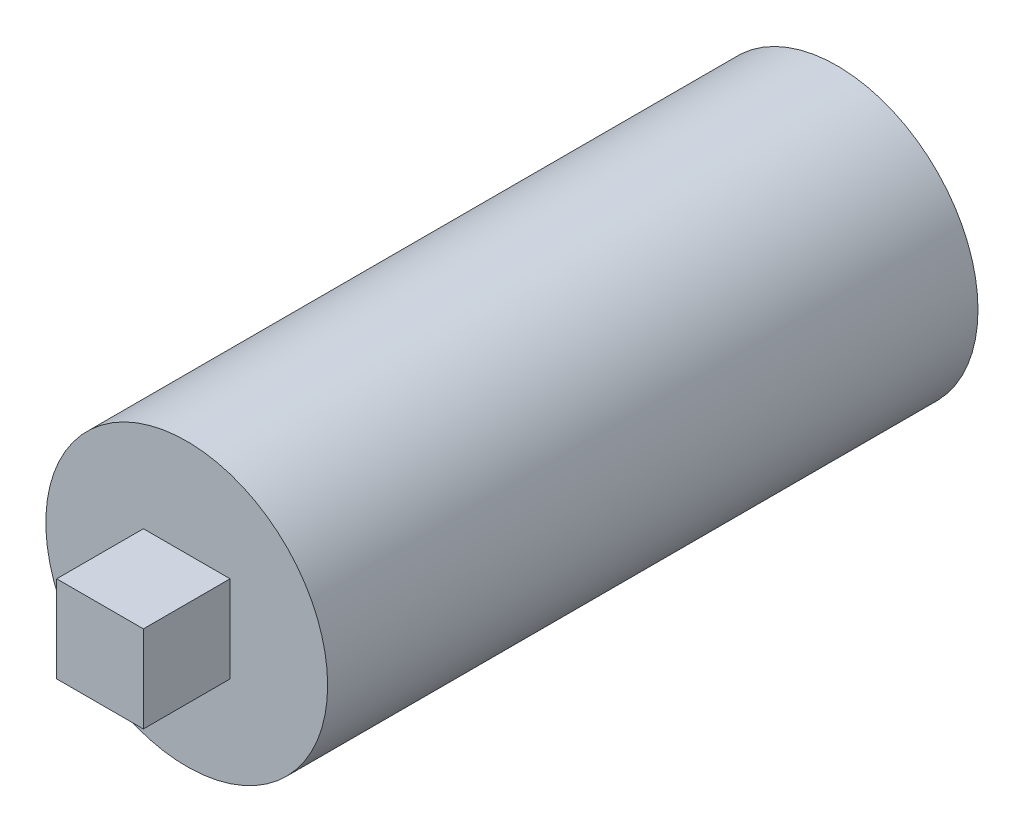
from build123d import *

# Parameters (mm, degrees)
IZIM2_R                     = 32.5
Y_KSEKLIK_EKSTR_ZYON1_DEPTH = 150
IZIM3_W                     = 20
IZIM3_H                     = 20
Y_KSEKLIK_EKSTR_ZYON2_DEPTH = 20
IZIM5_W                     = 20
IZIM5_H                     = 20
KES_EKSTR_ZYON2_DEPTH       = 20
IZIM6_W                     = 20.1
IZIM6_H                     = 20.1
KES_EKSTR_ZYON3_DEPTH       = 20


with BuildPart() as part:
    # Çizim2 → Yükseklik-Ekstrüzyon1 (new body)
    with BuildSketch(Plane.XY):
        Circle(IZIM2_R)
    extrude(amount=Y_KSEKLIK_EKSTR_ZYON1_DEPTH)

    # Çizim3 → Yükseklik-Ekstrüzyon2 (add)
    with BuildSketch(Plane.XY.offset(150)):
        Rectangle(IZIM3_W, IZIM3_H)
    extrude(amount=Y_KSEKLIK_EKSTR_ZYON2_DEPTH)

    # Çizim5 → Kes-Ekstrüzyon2 (cut)
    with BuildSketch(Plane(origin=(0, 0, 0), x_dir=(-1, 0, 0), z_dir=(0, 0, -1))):
        with Locations((0, 0.232689455)):
            Rectangle(IZIM5_W, IZIM5_H)
    extrude(amount=-KES_EKSTR_ZYON2_DEPTH, mode=Mode.SUBTRACT)

    # Çizim6 → Kes-Ekstrüzyon3 (cut)
    with BuildSketch(Plane(origin=(0, 0, 0), x_dir=(-1, 0, 0), z_dir=(0, 0, -1))):
        with Locations((0, 0.232689455)):
            Rectangle(IZIM6_W, IZIM6_H)
    extrude(amount=-KES_EKSTR_ZYON3_DEPTH, mode=Mode.SUBTRACT)


solid = part.part
